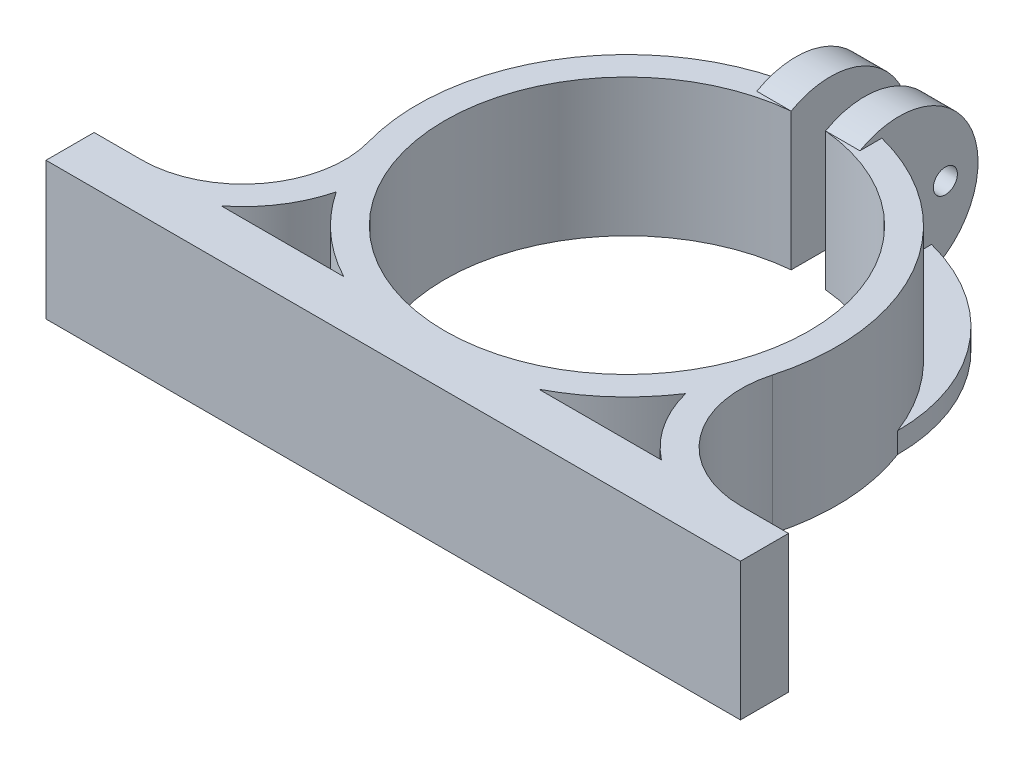
from build123d import *

# Parameters (mm, degrees)
SALIENTE_EXTRUIR1_DEPTH = 20
CROQUIS2_R              = 1.75
SALIENTE_EXTRUIR2_DEPTH = 5
MATRIZL1_COUNT          = 2
MATRIZL1_PITCH          = 10
SALIENTE_EXTRUIR3_DEPTH = 3


with BuildPart() as part:
    # Croquis1 → Saliente-Extruir1 (new body)
    with BuildSketch(Plane(origin=(0, 0, 0), x_dir=(1, 0, 0), z_dir=(0, 1, 0))):
        with BuildLine():
            Line((-50.5, 0), (50.5, 0))
            Line((50.5, 0), (50.5, 7))
            Line((50.5, 7), (43.6, 7))
            ThreePointArc((43.6, 7), (31.822793565, 12.849892164), (29.368318159, 25.768846465))
            ThreePointArc((29.368318159, 25.768846465), (25.038732007, 51.41585196), (2.5, 64.397368307))
            Line((2.5, 64.397368307), (2.5, 60.381811917))
            ThreePointArc((2.5, 60.381811917), (0, 7.5), (-2.5, 60.381811917))
            Line((-2.5, 60.381811917), (-2.5, 64.397368307))
            ThreePointArc((-2.5, 64.397368307), (-25.038732007, 51.41585196), (-29.368318159, 25.768846465))
            ThreePointArc((-29.368318159, 25.768846465), (-31.822793565, 12.849892164), (-43.6, 7))
            Line((-43.6, 7), (-50.5, 7))
            Line((-50.5, 7), (-50.5, 0))
        make_face()
        with BuildLine():
            Line((14.186260959, 7), (32.013771293, 7))
            ThreePointArc((32.013771293, 7), (27.872929965, 11.516026639), (25.406103057, 17.124576229))
            ThreePointArc((25.406103057, 17.124576229), (20.433198062, 11.356360342), (14.186260959, 7))
        make_face(mode=Mode.SUBTRACT)
        with BuildLine():
            Line((-32.013771293, 7), (-14.186260959, 7))
            ThreePointArc((-14.186260959, 7), (-20.433198062, 11.356360342), (-25.406103057, 17.124576229))
            ThreePointArc((-25.406103057, 17.124576229), (-27.872929965, 11.516026639), (-32.013771293, 7))
        make_face(mode=Mode.SUBTRACT)
    extrude(amount=SALIENTE_EXTRUIR1_DEPTH)

    # Croquis2 → Saliente-Extruir2 (add)
    with BuildSketch(Plane.ZY.offset(-2.5)):
        with BuildLine():
            Line((-60.381811917, 20), (-60.381811917, 0))
            Line((-60.381811917, 0), (-71.739628608, 0))
            ThreePointArc((-71.739628608, 0), (-76.060720262, 15.678908346), (-60.381811917, 20))
        make_face()
        with Locations((-72.810720262, 10)):
            Circle(CROQUIS2_R, mode=Mode.SUBTRACT)
    saliente_extruir2 = extrude(amount=-SALIENTE_EXTRUIR2_DEPTH)

    # MatrizL1: Saliente-Extruir2 ×2
    with Locations(*[(-i * MATRIZL1_PITCH, 0, 0) for i in range(1, MATRIZL1_COUNT)]):
        add(saliente_extruir2)

    # Croquis3 → Saliente-Extruir3 (add)
    with BuildSketch(Plane(origin=(0, 0, 0), x_dir=(1, 0, 0), z_dir=(0, 1, 0))):
        with BuildLine():
            Line((-7.5, 70.792294373), (-7.5, 63.563490998))
            ThreePointArc((-7.5, 63.563490998), (-20.283716212, 56.7776394), (-28.5, 44.862780491))
            add(Edge.make_bspline(
                [(-7.5, 70.792294373), (-28.5, 65.390312314), (-28.5, 44.862780491)],
                knots=[4.978682998, 4.978682998, 4.978682998, 6.283185307, 6.283185307, 6.283185307], degree=2, weights=[1, 0.794719414, 1]))
        make_face()
        with BuildLine():
            Line((7.5, 70.792294373), (7.5, 63.563490998))
            ThreePointArc((7.5, 63.563490998), (20.283716212, 56.7776394), (28.5, 44.862780491))
            add(Edge.make_bspline(
                [(28.5, 44.862780491), (28.5, 65.390312314), (7.5, 70.792294373)],
                knots=[3.141592654, 3.141592654, 3.141592654, 4.446094963, 4.446094963, 4.446094963], degree=2, weights=[1, 0.794719414, 1]))
        make_face()
    extrude(amount=SALIENTE_EXTRUIR3_DEPTH)


solid = part.part
